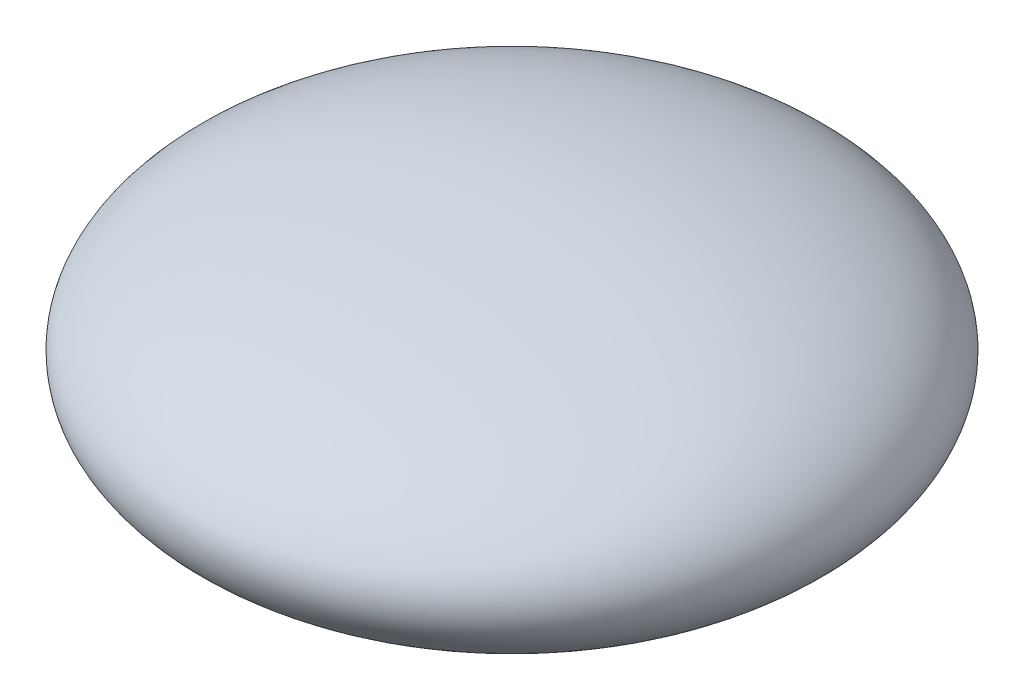
from build123d import *


with BuildPart() as part:
    # Sketch1 → Revolve2 (revolve)
    with BuildSketch(Plane.XY):
        with BuildLine():
            Line((0, 509.27), (0, 508))
            add(Edge.make_bspline(
                [(0, 508), (-1371.6, 508), (-1371.6, 0), (-1371.6, -508), (0, -508)],
                knots=[4.71238898, 4.71238898, 4.71238898, 6.283185307, 6.283185307, 7.853981634, 7.853981634, 7.853981634], degree=2, weights=[1, 0.707106781, 1, 0.707106781, 1]))
            Line((0, -508), (0, -509.27))
            add(Edge.make_bspline(
                [(0, 509.27), (-1372.87, 509.27), (-1372.87, 0), (-1372.87, -509.27), (0, -509.27)],
                knots=[4.71238898, 4.71238898, 4.71238898, 6.283185307, 6.283185307, 7.853981634, 7.853981634, 7.853981634], degree=2, weights=[1, 0.707106781, 1, 0.707106781, 1]))
        make_face()
    revolve(axis=Axis((0, 509.27, 0), (0, -1, 0)))


solid = part.part
